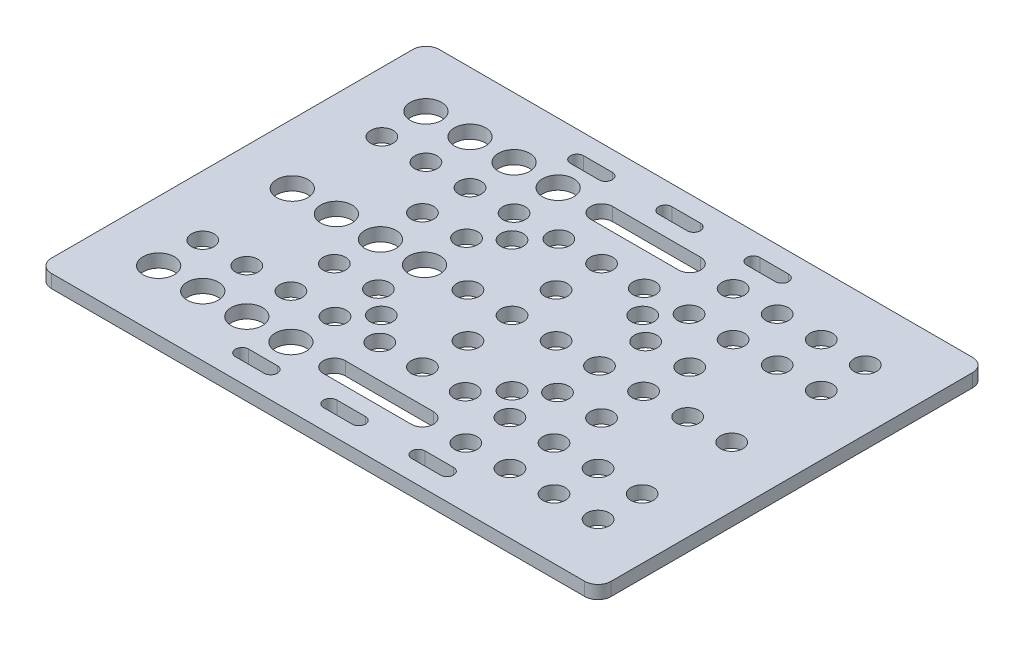
from build123d import *

# Parameters (mm, degrees)
SKETCH1_R           = 3.55
SKETCH1_R_2         = 2.55
BOSS_EXTRUDE1_DEPTH = 3


with BuildPart() as part:
    # Sketch1 → Boss-Extrude1 (new body)
    with BuildSketch(Plane(origin=(0, 0, 0), x_dir=(1, 0, 0), z_dir=(0, 1, 0))):
        with BuildLine():
            Line((60.5, -44), (-60.5, -44))
            ThreePointArc((-60.5, -44), (-62.621320344, -43.121320344), (-63.5, -41))
            Line((-63.5, -41), (-63.5, 41))
            ThreePointArc((-63.5, 41), (-62.621320344, 43.121320344), (-60.5, 44))
            Line((-60.5, 44), (60.5, 44))
            ThreePointArc((60.5, 44), (62.621320344, 43.121320344), (63.5, 41))
            Line((63.5, 41), (63.5, -41))
            ThreePointArc((63.5, -41), (62.621320344, -43.121320344), (60.5, -44))
        make_face()
        with Locations(Location((-39.85, 30.32, 0), (0, 0, 270))):
            Circle(SKETCH1_R, mode=Mode.SUBTRACT)
        with Locations(Location((0, 10, 0), (0, 0, 270))):
            Circle(SKETCH1_R_2, mode=Mode.SUBTRACT)
        with Locations(Location((0, 0, 0), (0, 0, 270))):
            Circle(SKETCH1_R_2, mode=Mode.SUBTRACT)
        with Locations(Location((10, 0, 0), (0, 0, 270))):
            Circle(SKETCH1_R_2, mode=Mode.SUBTRACT)
        with Locations(Location((-10, 0, 0), (0, 0, 90))):
            Circle(SKETCH1_R_2, mode=Mode.SUBTRACT)
        with Locations(Location((-49.85, 30.32, 0), (0, 0, 270))):
            Circle(SKETCH1_R, mode=Mode.SUBTRACT)
        with Locations(Location((-49.85, 0, 0), (0, 0, 270))):
            Circle(SKETCH1_R, mode=Mode.SUBTRACT)
        with Locations(Location((-49.85, -30.32, 0), (0, 0, 90))):
            Circle(SKETCH1_R, mode=Mode.SUBTRACT)
        with Locations(Location((-20.32, 10, 0), (0, 0, 270))):
            Circle(SKETCH1_R_2, mode=Mode.SUBTRACT)
        with Locations(Location((-30.32, 10, 0), (0, 0, 270))):
            Circle(SKETCH1_R_2, mode=Mode.SUBTRACT)
        with Locations(Location((-14.825, 14.825, 0), (0, 0, 270))):
            Circle(SKETCH1_R_2, mode=Mode.SUBTRACT)
        with Locations(Location((0, 20.32, 0), (0, 0, 270))):
            Circle(SKETCH1_R_2, mode=Mode.SUBTRACT)
        with Locations(Location((-49.85, 20.32, 0), (0, 0, 270))):
            Circle(SKETCH1_R_2, mode=Mode.SUBTRACT)
        with Locations(Location((-39.85, 20.32, 0), (0, 0, 270))):
            Circle(SKETCH1_R_2, mode=Mode.SUBTRACT)
        with Locations(Location((-29.85, 20.32, 0), (0, 0, 270))):
            Circle(SKETCH1_R_2, mode=Mode.SUBTRACT)
        with Locations(Location((-39.85, 0, 0), (0, 0, 270))):
            Circle(SKETCH1_R, mode=Mode.SUBTRACT)
        with Locations(Location((14.825, 14.825, 0), (0, 0, 90))):
            Circle(SKETCH1_R_2, mode=Mode.SUBTRACT)
        with Locations(Location((20.32, 10, 0), (0, 0, 90))):
            Circle(SKETCH1_R_2, mode=Mode.SUBTRACT)
        with Locations(Location((30.32, 10, 0), (0, 0, 90))):
            Circle(SKETCH1_R_2, mode=Mode.SUBTRACT)
        with Locations(Location((39.85, 30.32, 0), (0, 0, 270))):
            Circle(SKETCH1_R_2, mode=Mode.SUBTRACT)
        with Locations(Location((49.85, 30.32, 0), (0, 0, 270))):
            Circle(SKETCH1_R_2, mode=Mode.SUBTRACT)
        with Locations(Location((49.85, 0, 0), (0, 0, 270))):
            Circle(SKETCH1_R_2, mode=Mode.SUBTRACT)
        with Locations(Location((30.32, -10, 0), (0, 0, 270))):
            Circle(SKETCH1_R_2, mode=Mode.SUBTRACT)
        with Locations(Location((49.85, -30.32, 0), (0, 0, 90))):
            Circle(SKETCH1_R_2, mode=Mode.SUBTRACT)
        with Locations(Location((29.85, 30.32, 0), (0, 0, 270))):
            Circle(SKETCH1_R_2, mode=Mode.SUBTRACT)
        with Locations(Location((20.32, -10, 0), (0, 0, 270))):
            Circle(SKETCH1_R_2, mode=Mode.SUBTRACT)
        with Locations(Location((0, -10, 0), (0, 0, 90))):
            Circle(SKETCH1_R_2, mode=Mode.SUBTRACT)
        with Locations(Location((14.825, -14.825, 0), (0, 0, 270))):
            Circle(SKETCH1_R_2, mode=Mode.SUBTRACT)
        with Locations(Location((-29.85, 0, 0), (0, 0, 270))):
            Circle(SKETCH1_R, mode=Mode.SUBTRACT)
        with Locations(Location((-19.85, 20.32, 0), (0, 0, 270))):
            Circle(SKETCH1_R_2, mode=Mode.SUBTRACT)
        with Locations(Location((-9.69, 20.32, 0), (0, 0, 270))):
            Circle(SKETCH1_R_2, mode=Mode.SUBTRACT)
        with Locations(Location((9.69, 20.32, 0), (0, 0, 90))):
            Circle(SKETCH1_R_2, mode=Mode.SUBTRACT)
        with Locations(Location((-19.85, 0, 0), (0, 0, 270))):
            Circle(SKETCH1_R, mode=Mode.SUBTRACT)
        with Locations(Location((-14.825, -14.825, 0), (0, 0, 90))):
            Circle(SKETCH1_R_2, mode=Mode.SUBTRACT)
        with Locations(Location((-20.32, -10, 0), (0, 0, 90))):
            Circle(SKETCH1_R_2, mode=Mode.SUBTRACT)
        with Locations(Location((-30.32, -10, 0), (0, 0, 90))):
            Circle(SKETCH1_R_2, mode=Mode.SUBTRACT)
        with Locations(Location((-29.85, 30.32, 0), (0, 0, 270))):
            Circle(SKETCH1_R, mode=Mode.SUBTRACT)
        with Locations(Location((-19.85, 30.32, 0), (0, 0, 270))):
            Circle(SKETCH1_R, mode=Mode.SUBTRACT)
        with Locations(Location((19.85, 30.32, 0), (0, 0, 270))):
            Circle(SKETCH1_R_2, mode=Mode.SUBTRACT)
        with Locations(Location((19.85, 20.32, 0), (0, 0, 90))):
            Circle(SKETCH1_R_2, mode=Mode.SUBTRACT)
        with Locations(Location((29.85, 20.32, 0), (0, 0, 90))):
            Circle(SKETCH1_R_2, mode=Mode.SUBTRACT)
        with Locations(Location((39.85, 20.32, 0), (0, 0, 90))):
            Circle(SKETCH1_R_2, mode=Mode.SUBTRACT)
        with Locations(Location((49.85, 20.32, 0), (0, 0, 90))):
            Circle(SKETCH1_R_2, mode=Mode.SUBTRACT)
        with Locations(Location((39.85, 0, 0), (0, 0, 270))):
            Circle(SKETCH1_R_2, mode=Mode.SUBTRACT)
        with Locations(Location((29.85, 0, 0), (0, 0, 270))):
            Circle(SKETCH1_R_2, mode=Mode.SUBTRACT)
        with Locations(Location((19.85, 0, 0), (0, 0, 270))):
            Circle(SKETCH1_R_2, mode=Mode.SUBTRACT)
        with Locations(Location((19.85, -30.32, 0), (0, 0, 90))):
            Circle(SKETCH1_R_2, mode=Mode.SUBTRACT)
        with Locations(Location((29.85, -30.32, 0), (0, 0, 90))):
            Circle(SKETCH1_R_2, mode=Mode.SUBTRACT)
        with Locations(Location((0, -20.32, 0), (0, 0, 90))):
            Circle(SKETCH1_R_2, mode=Mode.SUBTRACT)
        with Locations(Location((39.85, -30.32, 0), (0, 0, 90))):
            Circle(SKETCH1_R_2, mode=Mode.SUBTRACT)
        with Locations(Location((49.85, -20.32, 0), (0, 0, 270))):
            Circle(SKETCH1_R_2, mode=Mode.SUBTRACT)
        with Locations(Location((39.85, -20.32, 0), (0, 0, 270))):
            Circle(SKETCH1_R_2, mode=Mode.SUBTRACT)
        with Locations(Location((29.85, -20.32, 0), (0, 0, 270))):
            Circle(SKETCH1_R_2, mode=Mode.SUBTRACT)
        with Locations(Location((19.85, -20.32, 0), (0, 0, 270))):
            Circle(SKETCH1_R_2, mode=Mode.SUBTRACT)
        with Locations(Location((9.69, -20.32, 0), (0, 0, 270))):
            Circle(SKETCH1_R_2, mode=Mode.SUBTRACT)
        with Locations(Location((-9.69, -20.32, 0), (0, 0, 90))):
            Circle(SKETCH1_R_2, mode=Mode.SUBTRACT)
        with Locations(Location((-19.85, -20.32, 0), (0, 0, 90))):
            Circle(SKETCH1_R_2, mode=Mode.SUBTRACT)
        with Locations(Location((-29.85, -20.32, 0), (0, 0, 90))):
            Circle(SKETCH1_R_2, mode=Mode.SUBTRACT)
        with Locations(Location((-39.85, -20.32, 0), (0, 0, 90))):
            Circle(SKETCH1_R_2, mode=Mode.SUBTRACT)
        with Locations(Location((-49.85, -20.32, 0), (0, 0, 90))):
            Circle(SKETCH1_R_2, mode=Mode.SUBTRACT)
        with Locations(Location((-19.85, -30.32, 0), (0, 0, 90))):
            Circle(SKETCH1_R, mode=Mode.SUBTRACT)
        with Locations(Location((-29.85, -30.32, 0), (0, 0, 90))):
            Circle(SKETCH1_R, mode=Mode.SUBTRACT)
        with Locations(Location((-39.85, -30.32, 0), (0, 0, 90))):
            Circle(SKETCH1_R, mode=Mode.SUBTRACT)
        with BuildLine():
            Line((10, 27.82), (-10, 27.82))
            ThreePointArc((-10, 27.82), (-12.5, 30.32), (-10, 32.82))
            Line((-10, 32.82), (10, 32.82))
            ThreePointArc((10, 32.82), (12.5, 30.32), (10, 27.82))
        make_face(mode=Mode.SUBTRACT)
        with BuildLine():
            Line((3.25, 36.5), (-3.25, 36.5))
            ThreePointArc((-3.25, 36.5), (-4.75, 38), (-3.25, 39.5))
            Line((-3.25, 39.5), (3.25, 39.5))
            ThreePointArc((3.25, 39.5), (4.75, 38), (3.25, 36.5))
        make_face(mode=Mode.SUBTRACT)
        with BuildLine():
            Line((-16.75, 36.5), (-23.25, 36.5))
            ThreePointArc((-23.25, 36.5), (-24.75, 38), (-23.25, 39.5))
            Line((-23.25, 39.5), (-16.75, 39.5))
            ThreePointArc((-16.75, 39.5), (-15.25, 38), (-16.75, 36.5))
        make_face(mode=Mode.SUBTRACT)
        with BuildLine():
            Line((16.75, 36.5), (23.25, 36.5))
            ThreePointArc((23.25, 36.5), (24.75, 38), (23.25, 39.5))
            Line((23.25, 39.5), (16.75, 39.5))
            ThreePointArc((16.75, 39.5), (15.25, 38), (16.75, 36.5))
        make_face(mode=Mode.SUBTRACT)
        with BuildLine():
            Line((10, -27.82), (-10, -27.82))
            ThreePointArc((-10, -27.82), (-12.5, -30.32), (-10, -32.82))
            Line((-10, -32.82), (10, -32.82))
            ThreePointArc((10, -32.82), (12.5, -30.32), (10, -27.82))
        make_face(mode=Mode.SUBTRACT)
        with BuildLine():
            Line((-16.75, -36.5), (-23.25, -36.5))
            ThreePointArc((-23.25, -36.5), (-24.75, -38), (-23.25, -39.5))
            Line((-23.25, -39.5), (-16.75, -39.5))
            ThreePointArc((-16.75, -39.5), (-15.25, -38), (-16.75, -36.5))
        make_face(mode=Mode.SUBTRACT)
        with BuildLine():
            Line((3.25, -36.5), (-3.25, -36.5))
            ThreePointArc((-3.25, -36.5), (-4.75, -38), (-3.25, -39.5))
            Line((-3.25, -39.5), (3.25, -39.5))
            ThreePointArc((3.25, -39.5), (4.75, -38), (3.25, -36.5))
        make_face(mode=Mode.SUBTRACT)
        with BuildLine():
            Line((16.75, -36.5), (23.25, -36.5))
            ThreePointArc((23.25, -36.5), (24.75, -38), (23.25, -39.5))
            Line((23.25, -39.5), (16.75, -39.5))
            ThreePointArc((16.75, -39.5), (15.25, -38), (16.75, -36.5))
        make_face(mode=Mode.SUBTRACT)
    extrude(amount=BOSS_EXTRUDE1_DEPTH)


solid = part.part
